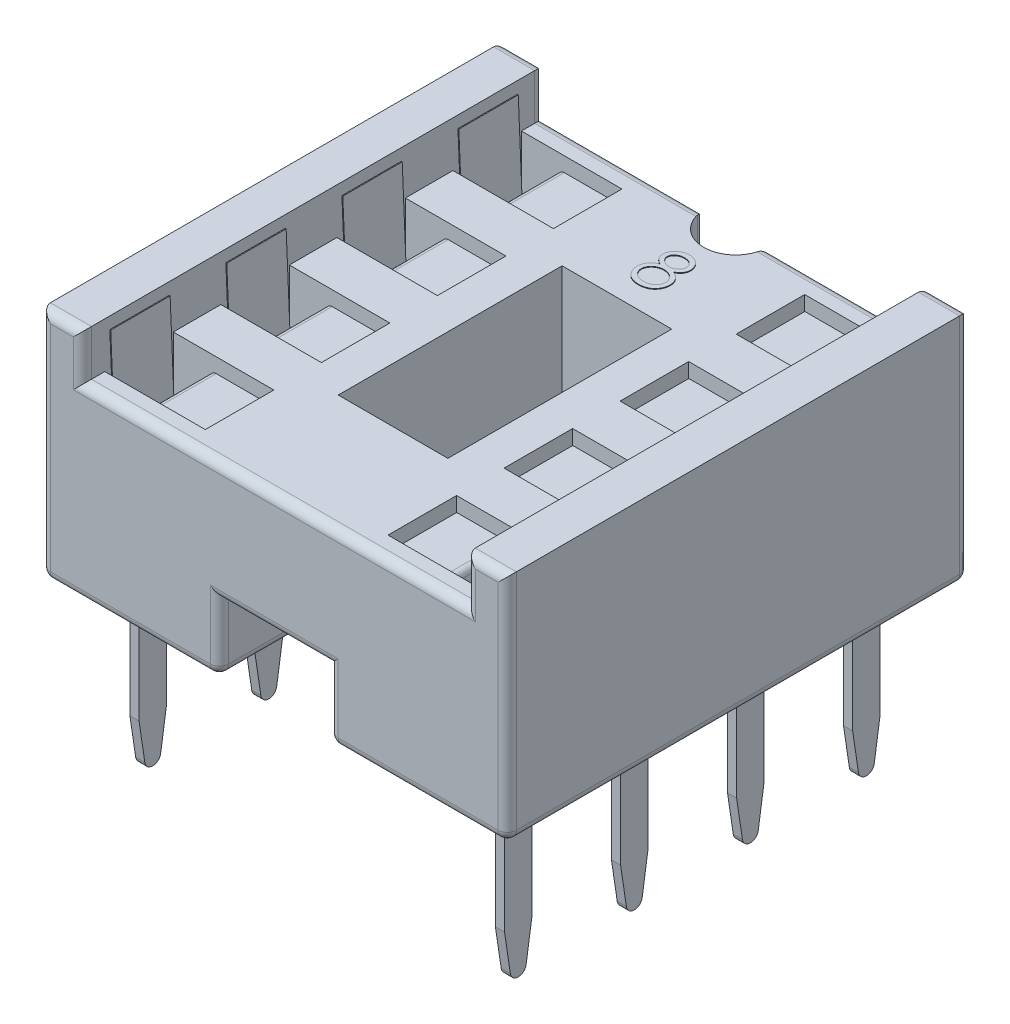
from build123d import *

# Parameters (mm, degrees)
SKETCH1_W           = 10.2
SKETCH1_H           = 10.1
SKETCH1_W_2         = 2.4
SKETCH1_H_2         = 4.9
BOSS_EXTRUDE1_DEPTH = 5.1
SKETCH2_W           = 8.4
SKETCH2_H           = 10.1
CUT_EXTRUDE1_DEPTH  = 1
CUT_EXTRUDE2_DEPTH  = 4.1
CUT_EXTRUDE3_REACH  = 14.411
SKETCH4_W           = 2.4
SKETCH4_H           = 1.5
SKETCH5_W           = 2.2
SKETCH5_H           = 1.5
CUT_EXTRUDE4_DEPTH  = 3.1
BOSS_EXTRUDE2_DEPTH = 0.015
SKETCH7_W           = 0.2
SKETCH7_H           = 0.6
BOSS_EXTRUDE3_DEPTH = 3.6
CUT_EXTRUDE5_REACH  = 13.668
LPATTERN1_COUNT     = 4
LPATTERN1_PITCH     = 2.54
FILLET1_R           = 0.2
SKETCH13_W          = 0.02
SKETCH13_H          = 1.3
LPATTERN2_COUNT     = 4
LPATTERN2_PITCH     = 2.54


with BuildPart() as part:
    # Sketch1 → Boss-Extrude1 (new body)
    with BuildSketch(Plane(origin=(0, 0, 0), x_dir=(1, 0, 0), z_dir=(0, 1, 0))):
        Rectangle(SKETCH1_W, SKETCH1_H)
        Rectangle(SKETCH1_W_2, SKETCH1_H_2, mode=Mode.SUBTRACT)
    extrude(amount=BOSS_EXTRUDE1_DEPTH)

    # Sketch2 → Cut-Extrude1 (cut)
    with BuildSketch(Plane(origin=(0, 5.1, 0), x_dir=(1, 0, 0), z_dir=(0, 1, 0))):
        Rectangle(SKETCH2_W, SKETCH2_H)
    extrude(amount=-CUT_EXTRUDE1_DEPTH, mode=Mode.SUBTRACT)

    # Sketch3 → Cut-Extrude2 (cut)
    with BuildSketch(Plane(origin=(0, 4.1, 0), x_dir=(1, 0, 0), z_dir=(0, 1, 0))):
        with BuildLine():
            Line((-0.7, 5.05), (0.7, 5.05))
            ThreePointArc((0.7, 5.05), (0, 4.35), (-0.7, 5.05))
        make_face()
    extrude(amount=-CUT_EXTRUDE2_DEPTH, mode=Mode.SUBTRACT)

    # Cut-Extrude3: up to this face of the body (flat: up to its plane)
    cut_extrude3_end = Plane(part.part.faces().sort_by_distance((0, 2.15522696, 5.05))[0])
    # Sketch4 → Cut-Extrude3 (cut, up to the picked face)
    with BuildSketch(Plane(origin=(0, 0, -5.05), x_dir=(-1, 0, 0), z_dir=(0, 0, -1)), mode=Mode.PRIVATE) as cut_extrude3_sk1:
        with Locations((0, 0.75)):
            Rectangle(SKETCH4_W, SKETCH4_H)
    cut_extrude3_tool1 = split(extrude(cut_extrude3_sk1.sketch, amount=-CUT_EXTRUDE3_REACH, mode=Mode.PRIVATE), bisect_by=cut_extrude3_end, keep=Keep.BOTH, mode=Mode.PRIVATE)
    add(cut_extrude3_tool1.solids().sort_by(Axis((0, 0.75, -5.05), (0, 0, 1)))[0], mode=Mode.SUBTRACT)

    # Sketch5 → Cut-Extrude4 (cut)
    with BuildSketch(Plane(origin=(0, 4.1, 0), x_dir=(1, 0, 0), z_dir=(0, 1, 0))):
        with Locations((-3.1, 3.81)):
            Rectangle(SKETCH5_W, SKETCH5_H)
        with Locations((-3.1, 1.27)):
            Rectangle(SKETCH5_W, SKETCH5_H)
        with Locations((-3.1, -1.27)):
            Rectangle(SKETCH5_W, SKETCH5_H)
        with Locations((-3.1, -3.81)):
            Rectangle(SKETCH5_W, SKETCH5_H)
        with Locations((3.1, -3.81)):
            Rectangle(SKETCH5_W, SKETCH5_H)
        with Locations((3.1, -1.27)):
            Rectangle(SKETCH5_W, SKETCH5_H)
        with Locations((3.1, 1.27)):
            Rectangle(SKETCH5_W, SKETCH5_H)
        with Locations((3.1, 3.81)):
            Rectangle(SKETCH5_W, SKETCH5_H)
    extrude(amount=-CUT_EXTRUDE4_DEPTH, mode=Mode.SUBTRACT)

    # Sketch6 → Boss-Extrude2 (add)
    with BuildSketch(Plane(origin=(0, 4.1, 0), x_dir=(1, 0, 0), z_dir=(0, 1, 0))):
        with BuildLine():
            add(Edge.make_bspline(
                [(0.155243389, 3.539588341), (0.163906164, 3.535071388), (0.180801469, 3.52626182), (0.204864101, 3.51207688), (0.226854756, 3.497126874), (0.247383569, 3.482117935), (0.266089867, 3.466475269), (0.282764488, 3.450136672), (0.297819315, 3.433509969), (0.310950748, 3.416313613), (0.322500744, 3.398593288), (0.332482985, 3.380302484), (0.341015329, 3.361481286), (0.347777456, 3.341924244), (0.353347855, 3.321918641), (0.357180716, 3.301206156), (0.359242022, 3.279923272), (0.359631735, 3.265539524), (0.35982906, 3.258256544)],
                knots=[0, 0, 0, 0, 1.272397273, 2.481599622, 3.635517121, 4.734568067, 5.792894095, 6.808321871, 7.773003508, 8.711915296, 9.623354172, 10.525449501, 11.423591555, 12.311487226, 13.218079475, 14.126165749, 15.051214107, 16, 16, 16, 16], degree=3))
            add(Edge.make_bspline(
                [(0.35982906, 3.258256544), (0.359595797, 3.248066991), (0.359134082, 3.227898044), (0.35511242, 3.198129815), (0.349091115, 3.169218633), (0.340298024, 3.141170837), (0.328894213, 3.114141193), (0.314840503, 3.088106564), (0.298931877, 3.062640249), (0.286155605, 3.046971049), (0.279690839, 3.039042468)],
                knots=[0, 0, 0, 0, 1.025265484, 2.029385089, 3.018602448, 3.995076438, 4.983346944, 5.966715145, 6.97116228, 8, 8, 8, 8], degree=3))
            add(Edge.make_bspline(
                [(0.279690839, 3.039042468), (0.271273619, 3.029791493), (0.254543194, 3.011403861), (0.225882642, 2.98753064), (0.194428406, 2.967467847), (0.160302195, 2.951117536), (0.123595234, 2.938391574), (0.084315342, 2.929246813), (0.042385943, 2.92400884), (0.013567384, 2.923251681), (-0.001216947, 2.922863248)],
                knots=[0, 0, 0, 0, 0.954267603, 1.896743057, 2.838368354, 3.796610408, 4.779680527, 5.799409237, 6.871065594, 8, 8, 8, 8], degree=3))
            add(Edge.make_bspline(
                [(-0.001216947, 2.922863248), (-0.0154329, 2.923211735), (-0.043095701, 2.923889856), (-0.083360107, 2.928484363), (-0.120892559, 2.936536123), (-0.155911288, 2.947556278), (-0.188205178, 2.961892228), (-0.217682211, 2.979735247), (-0.244767674, 3.000367136), (-0.268639584, 3.02438044), (-0.289832995, 3.050100321), (-0.308450001, 3.076634736), (-0.323924068, 3.103986108), (-0.337025356, 3.131746605), (-0.347054734, 3.160305323), (-0.354001093, 3.189515327), (-0.358412624, 3.219325597), (-0.358999586, 3.239443501), (-0.359294872, 3.249564303)],
                knots=[0, 0, 0, 0, 1.256902934, 2.445805442, 3.576955095, 4.645999104, 5.686449165, 6.692658513, 7.68621702, 8.689161843, 9.678783111, 10.630372946, 11.551080876, 12.453998257, 13.34127905, 14.221779781, 15.105423033, 16, 16, 16, 16], degree=3))
            add(Edge.make_bspline(
                [(-0.359294872, 3.249564303), (-0.359120132, 3.256990535), (-0.358774783, 3.27166739), (-0.356384508, 3.293350925), (-0.352541711, 3.314455947), (-0.34732278, 3.33506041), (-0.340249779, 3.355014309), (-0.331709896, 3.37441219), (-0.321751901, 3.393275953), (-0.310236882, 3.411708758), (-0.296840794, 3.429452325), (-0.281672262, 3.44680778), (-0.26442812, 3.463505821), (-0.245300209, 3.479750459), (-0.224507122, 3.495829861), (-0.201508774, 3.510875045), (-0.17691484, 3.525951144), (-0.159435587, 3.534964614), (-0.150469084, 3.539588341)],
                knots=[0, 0, 0, 0, 0.941657376, 1.861047343, 2.762797495, 3.66048619, 4.553285746, 5.444104102, 6.34607688, 7.256116206, 8.197091036, 9.162375105, 10.176350973, 11.237807142, 12.343728897, 13.50695164, 14.721116704, 16, 16, 16, 16], degree=3))
            add(Edge.make_bspline(
                [(-0.150469084, 3.539588341), (-0.162743142, 3.546281474), (-0.186509155, 3.559241252), (-0.217977772, 3.583052786), (-0.245007794, 3.608842196), (-0.266856244, 3.637154063), (-0.284053323, 3.667103951), (-0.295851805, 3.698504475), (-0.303833599, 3.730773395), (-0.304624273, 3.75281884), (-0.305021368, 3.763890558)],
                knots=[0, 0, 0, 0, 1.166880483, 2.259407225, 3.286803203, 4.280235371, 5.237608625, 6.161067461, 7.076446754, 8, 8, 8, 8], degree=3))
            add(Edge.make_bspline(
                [(-0.305021368, 3.763890558), (-0.304526846, 3.775168629), (-0.303532773, 3.797839519), (-0.295494483, 3.831587085), (-0.28239532, 3.864733047), (-0.264578733, 3.89711675), (-0.242387837, 3.927642172), (-0.215764238, 3.95502003), (-0.185343717, 3.979002312), (-0.151278124, 3.999133678), (-0.114618596, 4.015517784), (-0.075939317, 4.026820307), (-0.035914211, 4.034209324), (-0.008670377, 4.035045907), (0.005143229, 4.035470085)],
                knots=[0, 0, 0, 0, 0.888701115, 1.786444228, 2.72001202, 3.692817113, 4.693886446, 5.687152267, 6.695133018, 7.739871481, 8.800368666, 9.853104506, 10.91144658, 12, 12, 12, 12], degree=3))
            add(Edge.make_bspline(
                [(0.005143229, 4.035470085), (0.018600335, 4.035032739), (0.045136215, 4.034170341), (0.084141733, 4.026977642), (0.121463065, 4.014964192), (0.156971509, 3.998666699), (0.190031383, 3.978592552), (0.219242082, 3.954280859), (0.245045029, 3.927023771), (0.266388405, 3.896507606), (0.283975755, 3.864248338), (0.296222456, 3.830495813), (0.304069839, 3.795979312), (0.305059642, 3.772624011), (0.305555556, 3.760922476)],
                knots=[0, 0, 0, 0, 1.072916533, 2.115669174, 3.151510826, 4.193348718, 5.225979165, 6.227137561, 7.216255879, 8.211077061, 9.189680878, 10.138522389, 11.067357538, 12, 12, 12, 12], degree=3))
            add(Edge.make_bspline(
                [(0.305555556, 3.760922476), (0.305121772, 3.749439056), (0.304269845, 3.726886272), (0.297103435, 3.694009444), (0.285034409, 3.663220398), (0.268556412, 3.634169768), (0.247079657, 3.60738441), (0.220890826, 3.582523716), (0.190198713, 3.55938346), (0.167138873, 3.546324726), (0.155243389, 3.539588341)],
                knots=[0, 0, 0, 0, 0.975232327, 1.915300861, 2.843280834, 3.77672583, 4.742871857, 5.749627742, 6.839139064, 8, 8, 8, 8], degree=3))
        make_face()
        with BuildLine():
            add(Edge.make_bspline(
                [(-0.000156918, 3.926923077), (-0.007580614, 3.926726094), (-0.022104609, 3.926340708), (-0.043400898, 3.924327263), (-0.063652066, 3.920410457), (-0.083069701, 3.915197799), (-0.10138758, 3.908155955), (-0.118854481, 3.899872226), (-0.135173131, 3.889801107), (-0.150540525, 3.878503792), (-0.164374688, 3.86607808), (-0.176652731, 3.853132027), (-0.18685147, 3.839411373), (-0.195511996, 3.825257416), (-0.201795931, 3.810250075), (-0.20650228, 3.794849458), (-0.209683749, 3.778860949), (-0.209922143, 3.767933956), (-0.210042735, 3.762406517)],
                knots=[0, 0, 0, 0, 1.203892937, 2.355340988, 3.463153438, 4.544400666, 5.610487187, 6.640501085, 7.674077295, 8.714426146, 9.728707835, 10.68524104, 11.601827946, 12.495867327, 13.368432065, 14.231010473, 15.105153427, 16, 16, 16, 16], degree=3))
            add(Edge.make_bspline(
                [(-0.210042735, 3.762406517), (-0.209834888, 3.756878839), (-0.209424154, 3.745955354), (-0.206247603, 3.72982458), (-0.201513268, 3.713973275), (-0.194059378, 3.698778357), (-0.185119074, 3.683712722), (-0.174084747, 3.669152902), (-0.160934493, 3.655048226), (-0.146109529, 3.641518662), (-0.129958897, 3.628849274), (-0.112848961, 3.617850717), (-0.094994457, 3.608648021), (-0.076578831, 3.600988892), (-0.057414396, 3.59503503), (-0.037618581, 3.590811177), (-0.01718806, 3.588185907), (-0.003344884, 3.587872331), (0.003659188, 3.587713675)],
                knots=[0, 0, 0, 0, 0.873023192, 1.725219244, 2.590779336, 3.480155217, 4.391973325, 5.357036234, 6.360879153, 7.436073238, 8.526419356, 9.601555421, 10.645666583, 11.697338044, 12.750135903, 13.812665442, 14.89329948, 16, 16, 16, 16], degree=3))
            add(Edge.make_bspline(
                [(0.003659188, 3.587713675), (0.012655053, 3.587977614), (0.030557931, 3.588502884), (0.056949538, 3.593386691), (0.082610385, 3.601068956), (0.107266197, 3.611579708), (0.130278774, 3.624771942), (0.150792318, 3.640566212), (0.168631855, 3.658597822), (0.183611992, 3.67858606), (0.195226398, 3.699859041), (0.204268135, 3.721207224), (0.209548074, 3.742858375), (0.210236767, 3.757362671), (0.210576923, 3.764526576)],
                knots=[0, 0, 0, 0, 1.076279235, 2.141928126, 3.20205304, 4.278698113, 5.344010996, 6.36967002, 7.368914609, 8.37248503, 9.349703398, 10.264243087, 11.142681841, 12, 12, 12, 12], degree=3))
            add(Edge.make_bspline(
                [(0.210576923, 3.764526576), (0.210416087, 3.769554577), (0.210096852, 3.779534439), (0.20746612, 3.794271992), (0.203119142, 3.808674271), (0.197233878, 3.822860253), (0.189489963, 3.836630903), (0.180308412, 3.850202694), (0.169155241, 3.863270318), (0.156637748, 3.876138305), (0.142442351, 3.888047284), (0.126596406, 3.89852016), (0.109181153, 3.907413897), (0.09019618, 3.914637401), (0.069711405, 3.920062826), (0.047821179, 3.924125722), (0.024342977, 3.926415686), (0.008186838, 3.926750278), (-0.000156918, 3.926923077)],
                knots=[0, 0, 0, 0, 0.814439003, 1.616544685, 2.417341072, 3.248991801, 4.09997495, 4.973547432, 5.9003056, 6.880240646, 7.880314356, 8.896779544, 9.951930927, 11.043077905, 12.18215768, 13.381699519, 14.647792085, 16, 16, 16, 16], degree=3))
        make_face(mode=Mode.SUBTRACT)
        with BuildLine():
            add(Edge.make_bspline(
                [(0.005991253, 3.479166667), (-0.003420592, 3.478999256), (-0.021884335, 3.478670837), (-0.048934406, 3.475015203), (-0.074894768, 3.469926315), (-0.099677891, 3.462206275), (-0.123273311, 3.452168289), (-0.14580876, 3.440092845), (-0.16711184, 3.425818818), (-0.186888379, 3.409527556), (-0.204947576, 3.391971483), (-0.220791824, 3.373386504), (-0.234247027, 3.354118024), (-0.245082319, 3.333921326), (-0.253975867, 3.313224072), (-0.259816015, 3.291510823), (-0.263560009, 3.269199005), (-0.264062757, 3.254031547), (-0.264316239, 3.246384215)],
                knots=[0, 0, 0, 0, 1.140299081, 2.23698856, 3.303958914, 4.344563908, 5.37730929, 6.408454204, 7.439741482, 8.480804886, 9.510774543, 10.48932336, 11.43758569, 12.353841022, 13.263987381, 14.161954604, 15.073269652, 16, 16, 16, 16], degree=3))
            add(Edge.make_bspline(
                [(-0.264316239, 3.246384215), (-0.263904016, 3.236880107), (-0.263086174, 3.218024181), (-0.256598095, 3.190155823), (-0.246185445, 3.163177076), (-0.231663535, 3.137307795), (-0.213681673, 3.113132406), (-0.191569622, 3.092059847), (-0.16670156, 3.073335972), (-0.138236066, 3.058192572), (-0.107142696, 3.04609889), (-0.073429721, 3.037766492), (-0.037580972, 3.032250625), (-0.01282819, 3.031694794), (-0.000156918, 3.031410256)],
                knots=[0, 0, 0, 0, 0.898778495, 1.783155532, 2.693654817, 3.627872908, 4.583023416, 5.533784346, 6.509005473, 7.520592997, 8.575161974, 9.658835044, 10.801527049, 12, 12, 12, 12], degree=3))
            add(Edge.make_bspline(
                [(-0.000156918, 3.031410256), (0.00974617, 3.031600396), (0.02904056, 3.031970849), (0.057187978, 3.035240886), (0.083750496, 3.040426606), (0.108676604, 3.047969059), (0.132245336, 3.057176552), (0.154057089, 3.069021443), (0.174672977, 3.082493217), (0.193077128, 3.098476517), (0.209839075, 3.11555484), (0.224454142, 3.13363421), (0.237141306, 3.15222327), (0.247099, 3.171742107), (0.255059557, 3.191816246), (0.26078168, 3.212630793), (0.264312345, 3.23424959), (0.264669425, 3.248914785), (0.264850427, 3.256348491)],
                knots=[0, 0, 0, 0, 1.224942928, 2.386581632, 3.501229538, 4.569074225, 5.605009692, 6.626002462, 7.634866581, 8.645888296, 9.63523824, 10.59253846, 11.518950513, 12.414518923, 13.29783783, 14.186679152, 15.080837789, 16, 16, 16, 16], degree=3))
            add(Edge.make_bspline(
                [(0.264850427, 3.256348491), (0.264576516, 3.263568544), (0.264036411, 3.277805227), (0.260608411, 3.298901296), (0.254586229, 3.319282623), (0.246322945, 3.339194411), (0.235322035, 3.358233208), (0.222366562, 3.376895002), (0.206735245, 3.394661832), (0.189072389, 3.411671697), (0.169823132, 3.427400265), (0.149361876, 3.441314154), (0.127846122, 3.453032056), (0.105321399, 3.462562044), (0.081837721, 3.470057303), (0.057412362, 3.47529333), (0.032016724, 3.478589162), (0.014764418, 3.47897199), (0.005991253, 3.479166667)],
                knots=[0, 0, 0, 0, 0.917430815, 1.809013306, 2.70690318, 3.612392954, 4.541220862, 5.495268465, 6.494511384, 7.542276156, 8.608045339, 9.649016899, 10.681629292, 11.715607085, 12.752076957, 13.808767841, 14.885711793, 16, 16, 16, 16], degree=3))
        make_face(mode=Mode.SUBTRACT)
    extrude(amount=BOSS_EXTRUDE2_DEPTH)

    # Sketch7 → Boss-Extrude3 (add)
    with BuildSketch(Plane.XZ):
        with Locations((-4, 3.81)):
            Rectangle(SKETCH7_W, SKETCH7_H)
        with Locations((4, 3.81)):
            Rectangle(SKETCH7_W, SKETCH7_H)
        with Locations((4, 1.27)):
            Rectangle(SKETCH7_W, SKETCH7_H)
        with Locations((-4, 1.27)):
            Rectangle(SKETCH7_W, SKETCH7_H)
        with Locations((4, -1.27)):
            Rectangle(SKETCH7_W, SKETCH7_H)
        with Locations((-4, -1.27)):
            Rectangle(SKETCH7_W, SKETCH7_H)
        with Locations((4, -3.81)):
            Rectangle(SKETCH7_W, SKETCH7_H)
        with Locations((-4, -3.81)):
            Rectangle(SKETCH7_W, SKETCH7_H)
    extrude(amount=BOSS_EXTRUDE3_DEPTH)

    # Cut-Extrude5: up to this face of the body (flat: up to its plane)
    cut_extrude5_end = Plane(part.part.faces().sort_by_distance((4.1, -1.8, -3.81))[0])
    # Sketch8 → Cut-Extrude5 (cut, up to the picked face)
    with BuildSketch(Plane.ZY.offset(4.1), mode=Mode.PRIVATE) as cut_extrude5_sk1:
        with BuildLine():
            Line((-3.983084926, -3.450818761), (-4.11, -2.6))
            Line((-4.11, -2.6), (-4.11, -3.6))
            Line((-4.11, -3.6), (-3.81, -3.6))
            ThreePointArc((-3.81, -3.6), (-3.924251295, -3.557558069), (-3.983084926, -3.450818761))
        make_face()
    cut_extrude5_tool1 = split(extrude(cut_extrude5_sk1.sketch, amount=-CUT_EXTRUDE5_REACH, mode=Mode.PRIVATE), bisect_by=cut_extrude5_end, keep=Keep.BOTH, mode=Mode.PRIVATE)
    # Sketch8 → Cut-Extrude5 (cut, up to the picked face)
    with BuildSketch(Plane.ZY.offset(4.1), mode=Mode.PRIVATE) as cut_extrude5_sk2:
        with BuildLine():
            ThreePointArc((-3.636915074, -3.450818761), (-3.695748705, -3.557558069), (-3.81, -3.6))
            Line((-3.81, -3.6), (-3.51, -3.6))
            Line((-3.51, -3.6), (-3.51, -2.6))
            Line((-3.51, -2.6), (-3.636915074, -3.450818761))
        make_face()
    cut_extrude5_tool2 = split(extrude(cut_extrude5_sk2.sketch, amount=-CUT_EXTRUDE5_REACH, mode=Mode.PRIVATE), bisect_by=cut_extrude5_end, keep=Keep.BOTH, mode=Mode.PRIVATE)
    cut_extrude5_1 = cut_extrude5_tool1.solids().sort_by(Axis((-4.1, -3.284171, -4.05285), (1, 0, 0)))[0]
    add(cut_extrude5_1, mode=Mode.SUBTRACT)
    cut_extrude5_2 = cut_extrude5_tool2.solids().sort_by(Axis((-4.1, -3.284171, -3.56715), (1, 0, 0)))[0]
    add(cut_extrude5_2, mode=Mode.SUBTRACT)
    cut_extrude5 = cut_extrude5_1 + cut_extrude5_2  # Cut-Extrude5 as one shape, for the pattern or mirror that repeats it

    # LPattern1: Cut-Extrude5 ×4
    with Locations(*[(0, 0, i * LPATTERN1_PITCH) for i in range(1, LPATTERN1_COUNT)]):
        add(cut_extrude5, mode=Mode.SUBTRACT)

    # Fillet1
    fillet1_edges = [part.edges().sort_by_distance(p)[0] for p in [
        (-4.65, 5.1, 5.05),
        (1.2, 0, 0),
        (-1.2, 0, 0),
        (4.65, 5.1, 5.05),
        (-4.65, 5.1, -5.05),
        (4.2, 4.6, -5.05),
        (0, 4.1, 5.05),
        (4.2, 4.6, 5.05),
        (-4.2, 4.6, 5.05),
        (2.45, 4.1, -5.05),
        (-4.2, 4.6, -5.05),
        (-3.15, 0, 5.05),
        (-5.1, 0, 0),
        (-2.45, 4.1, -5.05),
        (3.15, 0, -5.05),
        (5.1, 0, 0),
        (-0.7, 2.8, -5.05),
        (0.7, 2.8, -5.05),
        (3.15, 0, 5.05),
        (-3.15, 0, -5.05),
        (4.65, 5.1, -5.05),
        (0.95, 1.5, -5.05),
        (1.2, 0.75, -5.05),
        (5.1, 2.55, 5.05),
        (-1.2, 0.75, -5.05),
        (-5.1, 2.55, 5.05),
        (-0.95, 1.5, -5.05),
        (-5.1, 2.55, -5.05),
        (1.2, 0.75, 5.05),
        (0, 1.5, 5.05),
        (-1.2, 0.75, 5.05),
        (5.1, 2.55, -5.05),
    ]]
    fillet(fillet1_edges, radius=FILLET1_R)


with BuildPart() as body_2:
    # Sweep7: sweep along a path in Sketch11
    with BuildLine(Plane.XY.offset(-3.81)) as sweep7_path:
        Line((-4.1, 4.85), (-3.955442773, 1.539095153))
        ThreePointArc((-3.955442773, 1.539095153), (-3.705680717, 1.3), (-3.455918662, 1.539095153))
        Line((-3.455918662, 1.539095153), (-3.359007579, 3.758723877))
        ThreePointArc((-3.359007579, 3.758723877), (-3.297500546, 3.894472792), (-3.159197934, 3.95))
        Line((-3.159197934, 3.95), (-2.1, 3.95))
    # Sketch13 → Sweep7 (sweep)
    with BuildSketch(Plane(origin=(0, 4.85, 0), x_dir=(1, 0, 0), z_dir=(0, 1, 0))):
        with Locations((-4.18, 3.81)):
            Rectangle(SKETCH13_W, SKETCH13_H)
    sweep(path=sweep7_path.line)


with BuildPart() as lpattern2_1:
    # LPattern2: pattern copy
    add(body_2.part.moved(Location(Vector(0, 0, 1) * (1 * LPATTERN2_PITCH))))


with BuildPart() as lpattern2_2:
    # LPattern2: pattern copy
    add(body_2.part.moved(Location(Vector(0, 0, 1) * (2 * LPATTERN2_PITCH))))


with BuildPart() as lpattern2_3:
    # LPattern2: pattern copy
    add(body_2.part.moved(Location(Vector(0, 0, 1) * (3 * LPATTERN2_PITCH))))


with BuildPart() as body_6:
    # Mirror4: mirrored copy
    add(body_2.part.mirror(Plane(origin=(0, 0, 0), x_dir=(0, 0, 1), z_dir=(1, 0, 0))))


with BuildPart() as body_7:
    # Mirror4 2: mirrored copy
    add(lpattern2_1.part.mirror(Plane(origin=(0, 0, 0), x_dir=(0, 0, 1), z_dir=(1, 0, 0))))


with BuildPart() as body_8:
    # Mirror4 3: mirrored copy
    add(lpattern2_2.part.mirror(Plane(origin=(0, 0, 0), x_dir=(0, 0, 1), z_dir=(1, 0, 0))))


with BuildPart() as body_9:
    # Mirror4 4: mirrored copy
    add(lpattern2_3.part.mirror(Plane(origin=(0, 0, 0), x_dir=(0, 0, 1), z_dir=(1, 0, 0))))


solid = Compound([part.part, body_2.part, lpattern2_1.part, lpattern2_2.part, lpattern2_3.part, body_6.part, body_7.part, body_8.part, body_9.part])
